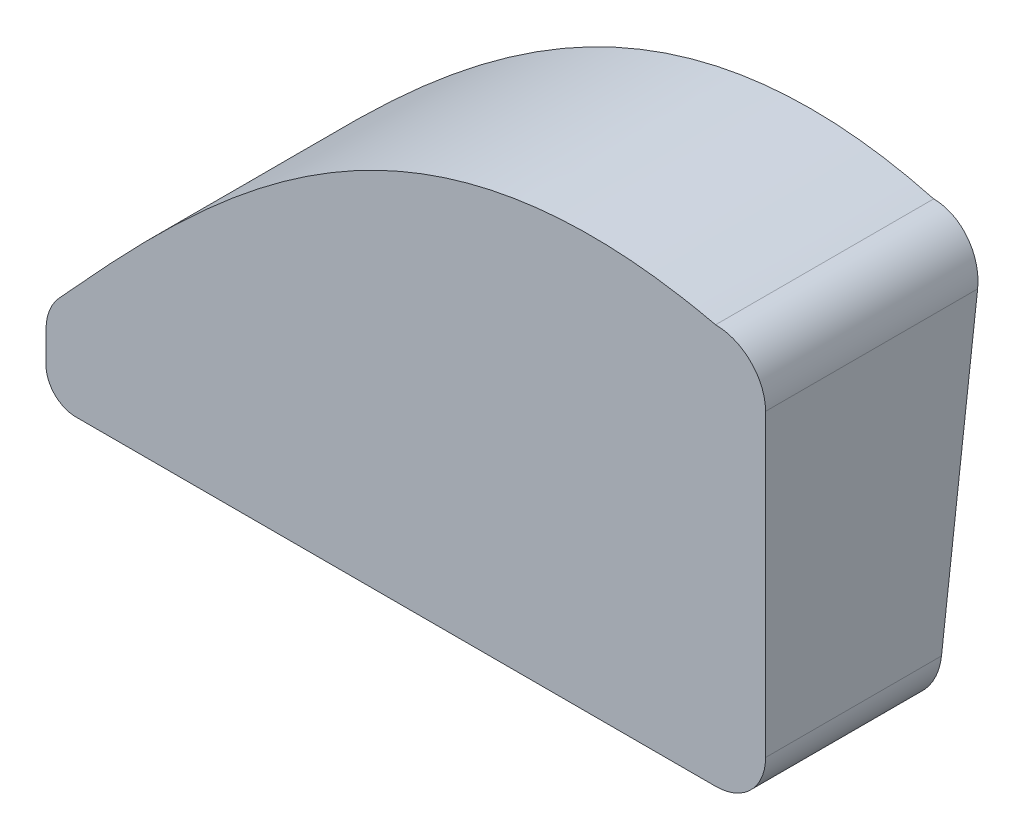
from build123d import *

# Parameters (mm, degrees)
BOSS_EXTRUDE1_DEPTH     = 22
CUT_EXTRUDE3_DEPTH      = 64.348491393
CUT_EXTRUDE3_DEPTH_BACK = 64.348491393


with BuildPart() as part:
    # Sketch1 → Boss-Extrude1 (new body)
    with BuildSketch(Plane.XY):
        with BuildLine():
            Line((54.303030303, 17.598954753), (54.303030303, -12.396681203))
            ThreePointArc((54.303030303, -12.396681203), (52.838564209, -15.932215109), (49.303030303, -17.396681203))
            Line((49.303030303, -17.396681203), (-14.695644242, -17.396681203))
            ThreePointArc((-14.695644242, -17.396681203), (-16.816964585, -16.518001547), (-17.695644242, -14.396681203))
            Line((-17.695644242, -14.396681203), (-17.695644242, -11.306720639))
            ThreePointArc((-17.695644242, -11.306720639), (-17.35823549, -9.50110638), (-16.3915471, -7.939184142))
            add(Edge.make_bspline(
                [(-16.3915471, -7.939184142), (-0.135926549, 9.901511722), (18.69690639, 29.725737375), (49.303030303, 22.598954753)],
                knots=[0.026299547, 0.026299547, 0.026299547, 0.026299547, 1, 1, 1, 1], degree=3))
            ThreePointArc((49.303030303, 22.598954753), (52.838564209, 21.134488659), (54.303030303, 17.598954753))
        make_face()
    extrude(amount=BOSS_EXTRUDE1_DEPTH)

    # Sketch3 → Cut-Extrude3 (cut, two sides: drawn at the far end of the back side and taken through both)
    with BuildSketch(Plane(origin=(0, 0, 0), x_dir=(0, 0, -1), z_dir=(1, 0, 0)).offset(-CUT_EXTRUDE3_DEPTH_BACK)):
        Polygon((12.434475201, 127.254636362), (0, 24.087595181), (-5, -17.396681203), (-17.434475201, -120.563722385), (188.899607163, -145.432672786), (218.768557564, 102.385685961), align=None)
    extrude(amount=CUT_EXTRUDE3_DEPTH + CUT_EXTRUDE3_DEPTH_BACK, mode=Mode.SUBTRACT)


solid = part.part
